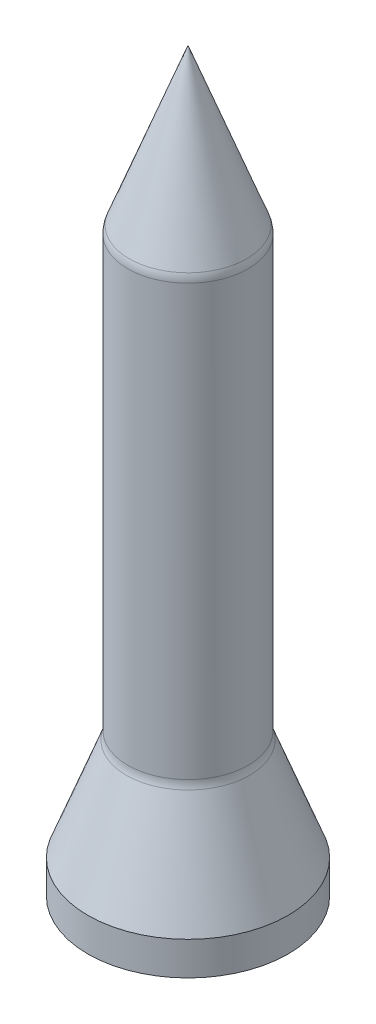
from build123d import *

# Parameters (mm, degrees)
FILLET1_R = 2
FILLET2_R = 2


with BuildPart() as part:
    # Sketch1 → Revolve1 (revolve)
    with BuildSketch(Plane(origin=(0, 0, 0), x_dir=(0, 0, -1), z_dir=(1, 0, 0))):
        Polygon((646.354904154, 148.232007839), (646.206991826, 83.082902173), (637.519532066, 83.082902173), (637.519532066, 86.045403185), (641.057510451, 95.417942416), (641.057510451, 134.198561364), align=None)
    revolve(axis=Axis((0, 148.309099824, -646.384005102), (0, -1, 0)))

    # Fillet1
    fillet1_edges = [part.edges().sort_by_distance(p)[0] for p in [
        (0, 95.417942416, -651.710499752),
    ]]
    fillet(fillet1_edges, radius=FILLET1_R)

    # Fillet2
    fillet2_edges = [part.edges().sort_by_distance(p)[0] for p in [
        (0, 134.198561364, -651.710499752),
    ]]
    fillet(fillet2_edges, radius=FILLET2_R)


solid = part.part
